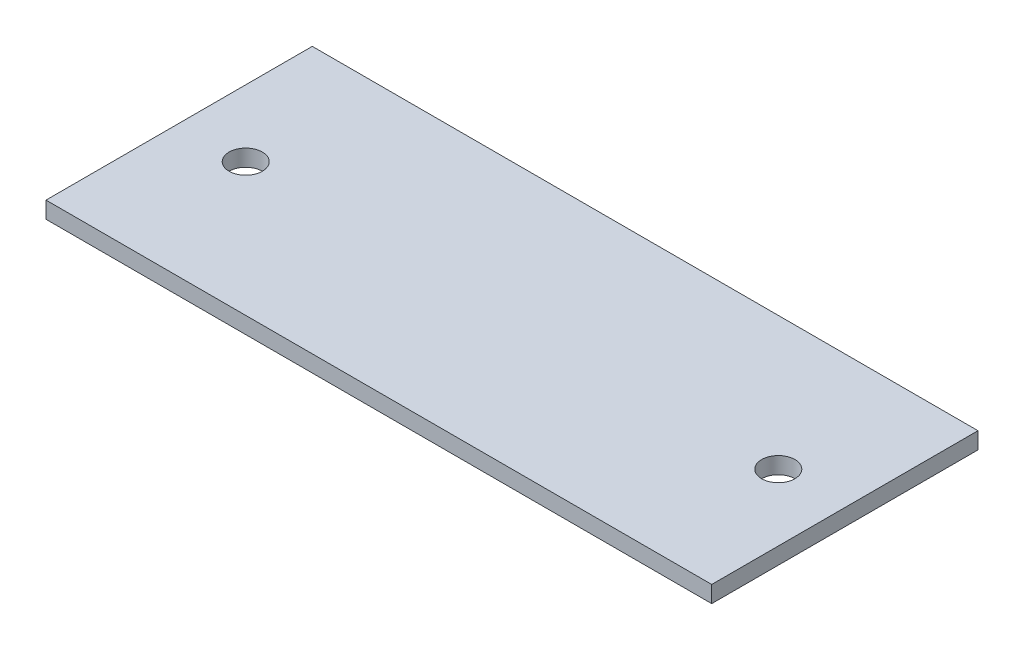
from build123d import *

# Parameters (mm, degrees)
SKETCH1_W           = 127
SKETCH1_H           = 50.8
BOSS_EXTRUDE1_DEPTH = 3.175
SKETCH2_R           = 3.175
CUT_EXTRUDE1_DEPTH  = 24.638


with BuildPart() as part:
    # Sketch1 → Boss-Extrude1 (new body)
    with BuildSketch(Plane(origin=(0, 0, 0), x_dir=(1, 0, 0), z_dir=(0, 1, 0))):
        with Locations((63.5, 25.4)):
            Rectangle(SKETCH1_W, SKETCH1_H)
    extrude(amount=BOSS_EXTRUDE1_DEPTH)

    # Sketch2 → Cut-Extrude1 (cut)
    with BuildSketch(Plane(origin=(0, 0, 0), x_dir=(-1, 0, 0), z_dir=(0, -1, 0))):
        with Locations(Location((-114.3, 25.4, 0), (0, 0, 90))):
            Circle(SKETCH2_R)
        with Locations(Location((-12.7, 25.4, 0), (0, 0, 90))):
            Circle(SKETCH2_R)
    extrude(amount=-CUT_EXTRUDE1_DEPTH, mode=Mode.SUBTRACT)


solid = part.part
